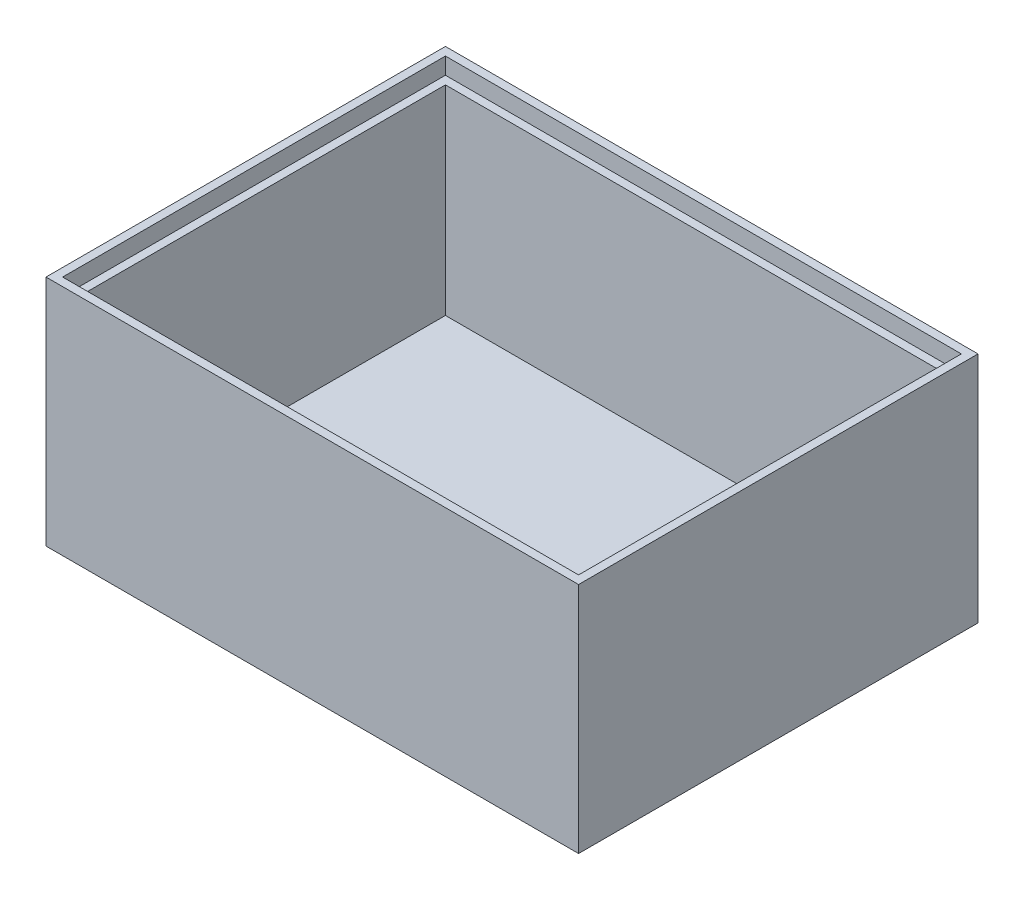
from build123d import *

# Parameters (mm, degrees)
SKETCH1_W           = 203.2
SKETCH1_H           = 152.4
BOSS_EXTRUDE1_DEPTH = 6.35
SKETCH2_W           = 203.2
SKETCH2_H           = 152.4
SKETCH2_W_2         = 190.5
SKETCH2_H_2         = 139.7
BOSS_EXTRUDE2_DEPTH = 76.2
SKETCH3_W           = 203.2
SKETCH3_H           = 152.4
SKETCH3_W_2         = 196.85
SKETCH3_H_2         = 146.05
BOSS_EXTRUDE3_DEPTH = 6.35


with BuildPart() as part:
    # Sketch1 → Boss-Extrude1 (new body)
    with BuildSketch(Plane(origin=(0, 0, 0), x_dir=(1, 0, 0), z_dir=(0, 1, 0))):
        Rectangle(SKETCH1_W, SKETCH1_H)
    extrude(amount=BOSS_EXTRUDE1_DEPTH)

    # Sketch2 → Boss-Extrude2 (add)
    with BuildSketch(Plane(origin=(0, 6.35, 0), x_dir=(1, 0, 0), z_dir=(0, 1, 0))):
        Rectangle(SKETCH2_W, SKETCH2_H)
        Rectangle(SKETCH2_W_2, SKETCH2_H_2, mode=Mode.SUBTRACT)
    extrude(amount=BOSS_EXTRUDE2_DEPTH)

    # Sketch3 → Boss-Extrude3 (add)
    with BuildSketch(Plane(origin=(0, 82.55, 0), x_dir=(1, 0, 0), z_dir=(0, 1, 0))):
        Rectangle(SKETCH3_W, SKETCH3_H)
        Rectangle(SKETCH3_W_2, SKETCH3_H_2, mode=Mode.SUBTRACT)
    extrude(amount=BOSS_EXTRUDE3_DEPTH)


solid = part.part
